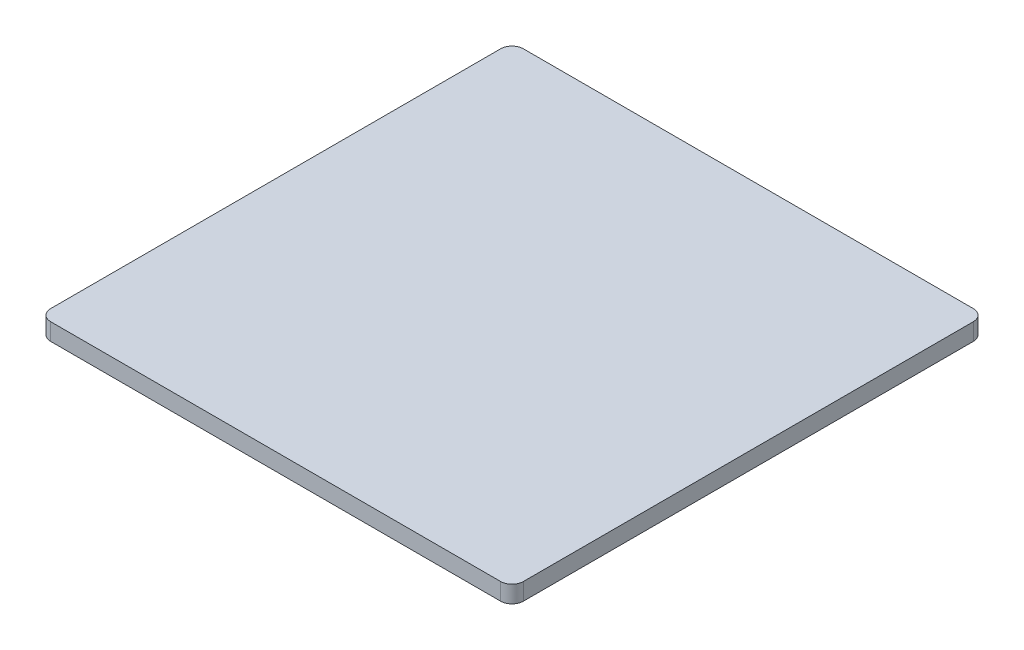
from build123d import *

# Parameters (mm, degrees)
BOSS_EXTRUDE1_DEPTH = 15
CUT_EXTRUDE1_DEPTH  = 10.5
CHAMFER1_SIZE       = 10


with BuildPart() as part:
    # Sketch1 → Boss-Extrude1 (new body)
    with BuildSketch(Plane(origin=(0, 0, 0), x_dir=(1, 0, 0), z_dir=(0, 1, 0))):
        with BuildLine():
            Line((-197.5, 207.5), (197.5, 207.5))
            ThreePointArc((197.5, 207.5), (204.571067812, 204.571067812), (207.5, 197.5))
            Line((207.5, 197.5), (207.5, -197.5))
            ThreePointArc((207.5, -197.5), (204.571067812, -204.571067812), (197.5, -207.5))
            Line((197.5, -207.5), (-197.5, -207.5))
            ThreePointArc((-197.5, -207.5), (-204.571067812, -204.571067812), (-207.5, -197.5))
            Line((-207.5, -197.5), (-207.5, 197.5))
            ThreePointArc((-207.5, 197.5), (-204.571067812, 204.571067812), (-197.5, 207.5))
        make_face()
    extrude(amount=-BOSS_EXTRUDE1_DEPTH)

    # Sketch2 → Cut-Extrude1 (cut)
    with BuildSketch(Plane.XZ.offset(15)):
        Polygon((-190, -200), (190, -200), (200, -190), (200, 190), (190, 200), (-190, 200), (-200, 190), (-200, -190), align=None)
        with BuildLine():
            Line((-175, -195), (175, -195))
            ThreePointArc((175, -195), (189.142135624, -189.142135624), (195, -175))
            Line((195, -175), (195, 175))
            ThreePointArc((195, 175), (189.142135624, 189.142135624), (175, 195))
            Line((175, 195), (-175, 195))
            ThreePointArc((-175, 195), (-189.142135624, 189.142135624), (-195, 175))
            Line((-195, 175), (-195, -175))
            ThreePointArc((-195, -175), (-189.142135624, -189.142135624), (-175, -195))
        make_face(mode=Mode.SUBTRACT)
    extrude(amount=-CUT_EXTRUDE1_DEPTH, mode=Mode.SUBTRACT)

    # Chamfer1
    chamfer1_edges = [part.edges().sort_by_distance(p)[0] for p in [
        (189.142135624, -15, -189.142135624),
        (0, -15, -195),
        (-189.142135624, -15, -189.142135624),
        (-195, -15, 0),
        (-189.142135624, -15, 189.142135624),
        (0, -15, 195),
        (189.142135624, -15, 189.142135624),
        (195, -15, 0),
    ]]
    chamfer(chamfer1_edges, length=CHAMFER1_SIZE)


solid = part.part
